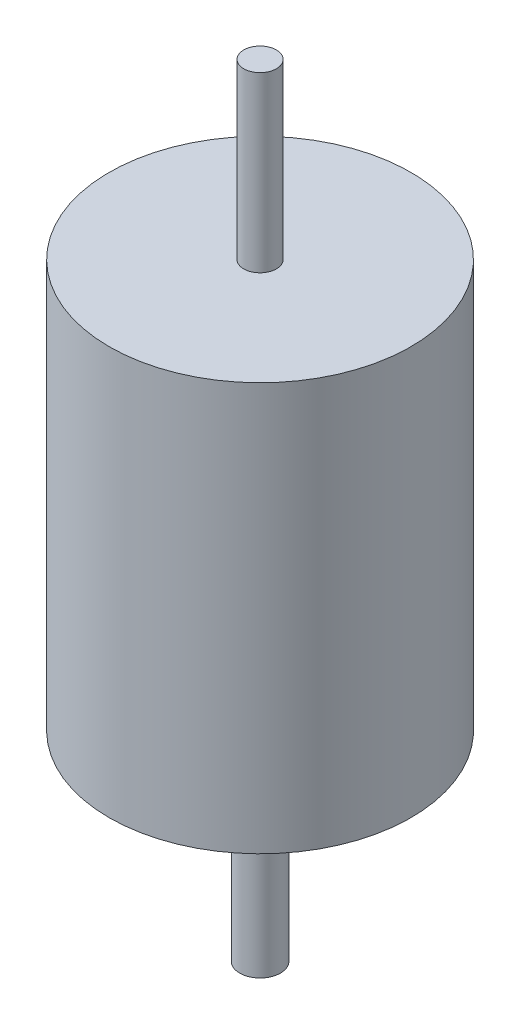
from build123d import *

# Parameters (mm, degrees)
SKETCH1_R           = 7.4
BOSS_EXTRUDE1_DEPTH = 20
SKETCH2_R           = 0.8
BOSS_EXTRUDE2_DEPTH = 8.5
SKETCH3_R           = 1
BOSS_EXTRUDE3_DEPTH = 9.8


with BuildPart() as part:
    # Sketch1 → Boss-Extrude1 (new body)
    with BuildSketch(Plane(origin=(0, 0, 0), x_dir=(1, 0, 0), z_dir=(0, 1, 0))):
        with Locations(Location((0, 0, 0), (0, 0, 270))):
            Circle(SKETCH1_R)
    extrude(amount=BOSS_EXTRUDE1_DEPTH)

    # Sketch2 → Boss-Extrude2 (add)
    with BuildSketch(Plane(origin=(0, 20, 0), x_dir=(1, 0, 0), z_dir=(0, 1, 0))):
        with Locations(Location((0, 0, 0), (0, 0, 270))):
            Circle(SKETCH2_R)
    extrude(amount=BOSS_EXTRUDE2_DEPTH)

    # Sketch3 → Boss-Extrude3 (add)
    with BuildSketch(Plane.XZ):
        with Locations(Location((0, 0, 0), (0, 0, 90))):
            Circle(SKETCH3_R)
    extrude(amount=BOSS_EXTRUDE3_DEPTH)


solid = part.part
